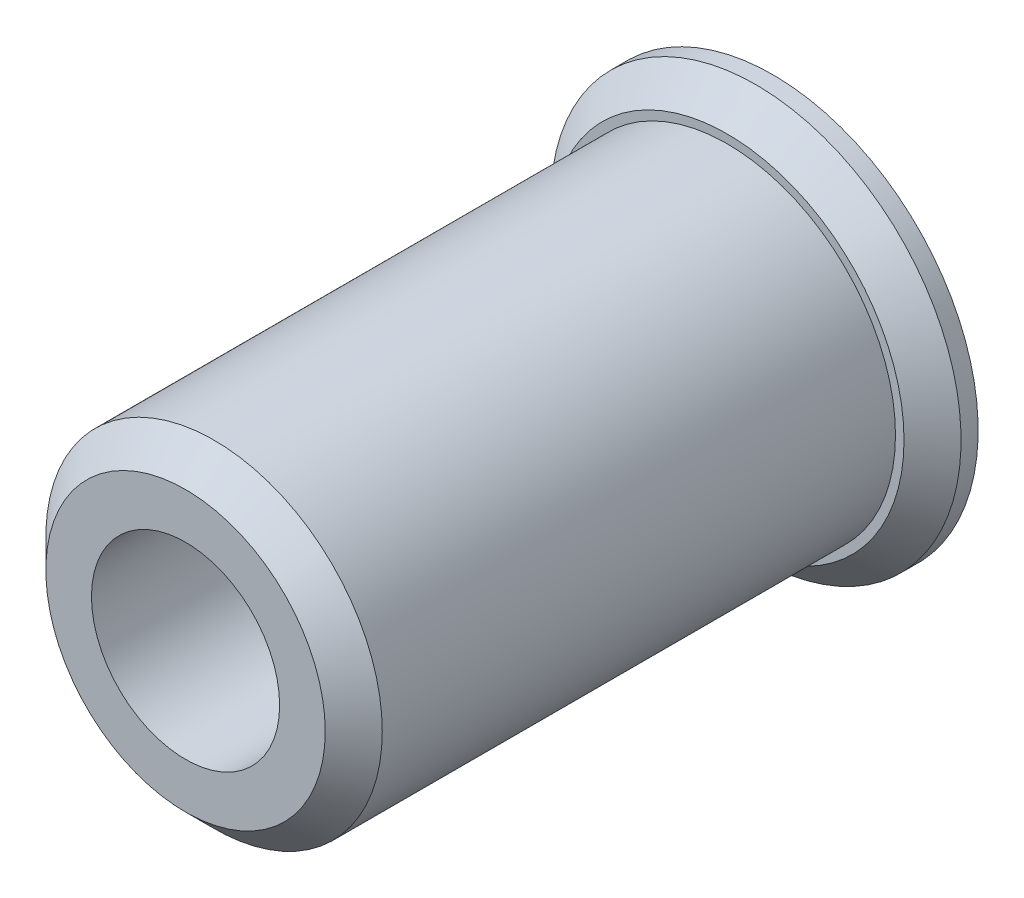
from build123d import *

# Parameters (mm, degrees)
ESQUISSE1_R             = 3.6
BOSS_EXTRU_1_DEPTH      = 10.3
ESQUISSE2_OUTSIDE_W     = 12.096
ESQUISSE2_OUTSIDE_H     = 12.096
ESQUISSE2_OUTSIDE_R     = 2.95
ENL_V_MAT_EXTRU_1_DEPTH = 9.5
TROU_TARAUD_M41_D       = 3.3
CHANFREIN1_SIZE         = 0.5


with BuildPart() as part:
    # Esquisse1 → Boss.-Extru.1 (new body)
    with BuildSketch(Plane.XY):
        with Locations(Location((0, 0, 0), (0, 0, 180))):
            Circle(ESQUISSE1_R)
    extrude(amount=BOSS_EXTRU_1_DEPTH)

    # Esquisse2 outside → Enlèv. mat.-Extru.1 (cut)
    with BuildSketch(Plane.XY.offset(10.3)):
        Rectangle(ESQUISSE2_OUTSIDE_W, ESQUISSE2_OUTSIDE_H)
        Circle(ESQUISSE2_OUTSIDE_R, mode=Mode.SUBTRACT)
    extrude(amount=-ENL_V_MAT_EXTRU_1_DEPTH, mode=Mode.SUBTRACT)

    # Trou taraudé M41 (through all)
    with Locations(Plane(origin=(0, 0, 0), x_dir=(-1, 0, 0), z_dir=(0, 0, -1))):
        with Locations((0, 0)):
            Hole(TROU_TARAUD_M41_D / 2)

    # Chanfrein1
    chanfrein1_edges = [part.edges().sort_by_distance(p)[0] for p in [
        (-2.95, 0, 10.3),
        (3.6, 0, 0.8),
    ]]
    chamfer(chanfrein1_edges, length=CHANFREIN1_SIZE)


solid = part.part
